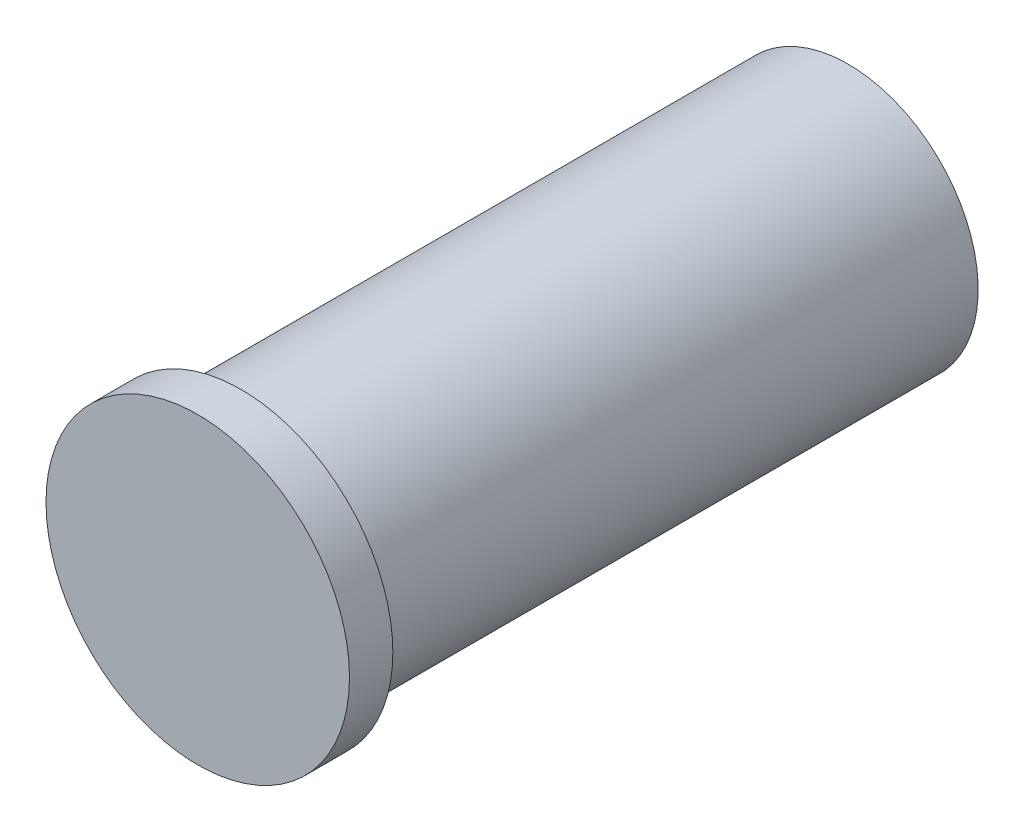
from build123d import *

# Parameters (mm, degrees)
SKETCH1_R           = 1.5
BOSS_EXTRUDE1_DEPTH = 2
SKETCH2_R           = 1.75
BOSS_EXTRUDE2_DEPTH = 0.5
BOSS_EXTRUDE3_START = 5
SKETCH3_R           = 1.5
BOSS_EXTRUDE3_DEPTH = 5


with BuildPart() as part:
    # Sketch1 → Boss-Extrude1 (new body)
    with BuildSketch(Plane.XY):
        Circle(SKETCH1_R)
    extrude(amount=BOSS_EXTRUDE1_DEPTH)

    # Sketch2 → Boss-Extrude2 (add)
    with BuildSketch(Plane.XY.offset(2)):
        Circle(SKETCH2_R)
    extrude(amount=BOSS_EXTRUDE2_DEPTH)

    # Sketch3 → Boss-Extrude3 (add)
    with BuildSketch(Plane(origin=(0, 0, 0), x_dir=(-1, 0, 0), z_dir=(0, 0, -1)).offset(BOSS_EXTRUDE3_START)):
        Circle(SKETCH3_R)
    extrude(amount=-BOSS_EXTRUDE3_DEPTH)


solid = part.part
